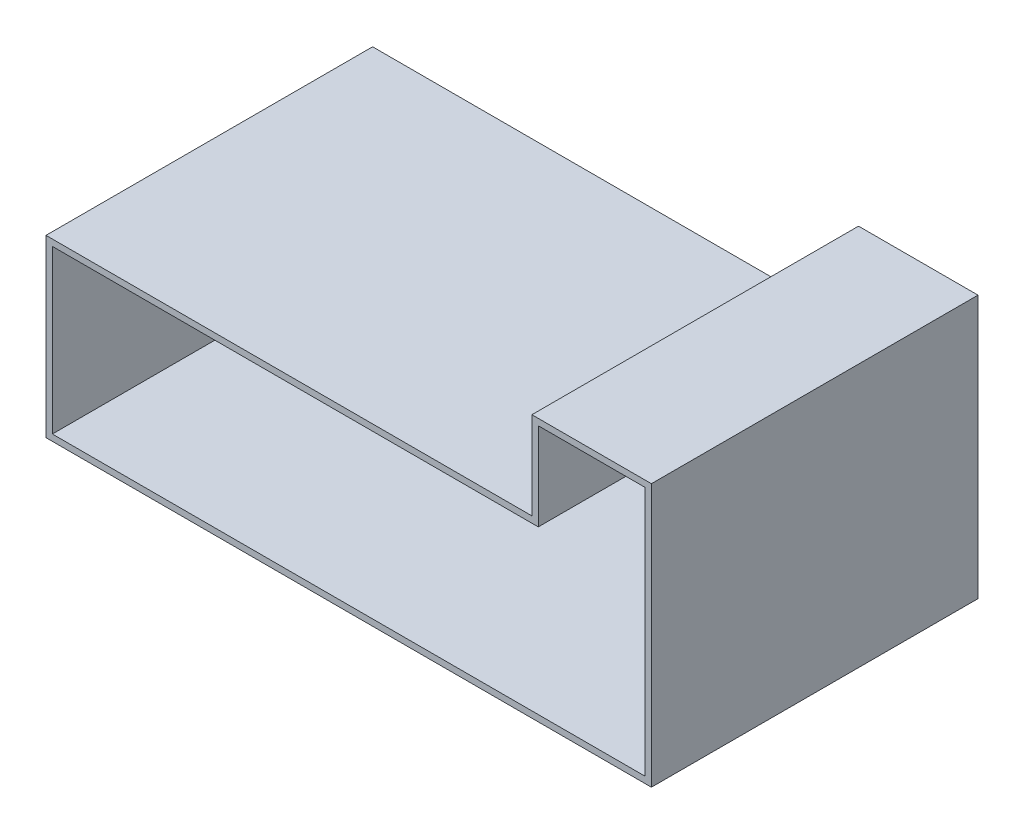
from build123d import *

# Parameters (mm, degrees)
SKETCH1_W           = 610
SKETCH1_H           = 410
BOSS_EXTRUDE1_DEPTH = 220
SKETCH2_W           = 410
SKETCH2_H           = 330
BOSS_EXTRUDE2_DEPTH = 150
SKETCH3_W           = 602
SKETCH3_H           = 204
CUT_EXTRUDE1_DEPTH  = 402
SKETCH5_W           = 142
SKETCH5_H           = 204
CUT_EXTRUDE2_DEPTH  = 402
SKETCH6_W           = 134
SKETCH6_H           = 110
CUT_EXTRUDE3_DEPTH  = 402


with BuildPart() as part:
    # Sketch1 → Boss-Extrude1 (new body)
    with BuildSketch(Plane(origin=(0, 0, 0), x_dir=(1, 0, 0), z_dir=(0, 1, 0))):
        with Locations((-210.221238938, -108.849557522)):
            Rectangle(SKETCH1_W, SKETCH1_H)
    extrude(amount=BOSS_EXTRUDE1_DEPTH)

    # Sketch2 → Boss-Extrude2 (add)
    with BuildSketch(Plane(origin=(94.778761062, 0, 0), x_dir=(0, 0, -1), z_dir=(1, 0, 0))):
        with Locations((-108.849557522, 165)):
            Rectangle(SKETCH2_W, SKETCH2_H)
    extrude(amount=BOSS_EXTRUDE2_DEPTH)

    # Sketch3 → Cut-Extrude1 (cut)
    with BuildSketch(Plane.XY.offset(313.849557522)):
        with Locations((-206.221238938, 110)):
            Rectangle(SKETCH3_W, SKETCH3_H)
    extrude(amount=-CUT_EXTRUDE1_DEPTH, mode=Mode.SUBTRACT)

    # Sketch5 → Cut-Extrude2 (cut)
    with BuildSketch(Plane.XY.offset(313.849557522)):
        with Locations((165.778761062, 110)):
            Rectangle(SKETCH5_W, SKETCH5_H)
    extrude(amount=-CUT_EXTRUDE2_DEPTH, mode=Mode.SUBTRACT)

    # Sketch6 → Cut-Extrude3 (cut)
    with BuildSketch(Plane.XY.offset(313.849557522)):
        with Locations((169.778761062, 267)):
            Rectangle(SKETCH6_W, SKETCH6_H)
    extrude(amount=-CUT_EXTRUDE3_DEPTH, mode=Mode.SUBTRACT)


solid = part.part
